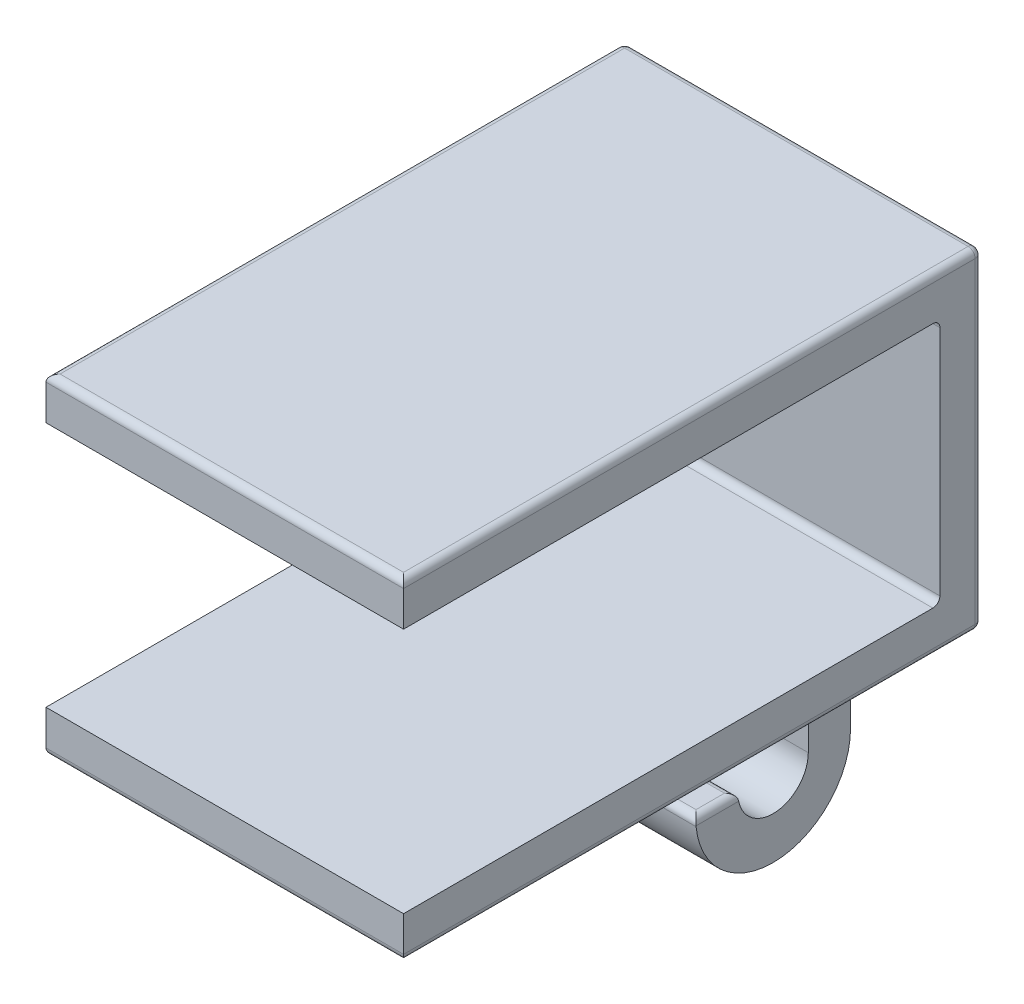
from build123d import *

# Parameters (mm, degrees)
BOSS_EXTRUDE1_DEPTH = 25.4
BOSS_EXTRUDE3_DEPTH = 25.4
CUT_EXTRUDE5_DEPTH  = 6.35
CUT_EXTRUDE6_START  = -6.35
CUT_EXTRUDE6_DEPTH  = 6.35
FILLET1_R           = 2.5
FILLET2_R           = 2.5
FILLET3_R           = 0.5
FILLET4_R           = 0.5
FILLET5_R           = 0.5


with BuildPart() as part:
    # Sketch1 → Boss-Extrude1 (new body)
    with BuildSketch(Plane(origin=(0, 0, 0), x_dir=(0, 0, -1), z_dir=(1, 0, 0))):
        Polygon((0, 0), (38.1, 0), (38.1, -17.5), (0, -17.5), (1.83e-15, -20.500000000000007), (41.1, -20.500000000000007), (41.099999999999994, 3), (-1.8e-16, 2.999999999999995), align=None)
    extrude(amount=BOSS_EXTRUDE1_DEPTH)

    # Sketch7 → Boss-Extrude3 (add)
    with BuildSketch(Plane.ZY):
        with BuildLine():
            Line((-38.1, -20.500000000000007), (-38.10000000000001, -28.33631785905126))
            ThreePointArc((-38.10000000000001, -28.33631785905126), (-32.6, -33.83631785905126), (-27.100000000000005, -28.336317859051263))
            Line((-27.100000000000005, -28.336317859051263), (-30.100000000000005, -28.33631785905126))
            ThreePointArc((-30.100000000000005, -28.33631785905126), (-32.607239712312804, -30.821806864386282), (-35.1, -28.32179632065465))
            Line((-35.1, -28.32179632065465), (-35.1, -20.500000000000007))
            Line((-35.1, -20.500000000000007), (-38.1, -20.500000000000007))
        make_face()
    extrude(amount=-BOSS_EXTRUDE3_DEPTH)

    # Sketch8 → Cut-Extrude5 (cut)
    with BuildSketch(Plane.ZY):
        with BuildLine():
            Line((-35.1, -20.500000000000007), (-38.1, -20.500000000000007))
            Line((-38.1, -20.500000000000007), (-38.10000000000001, -28.3363178590513))
            ThreePointArc((-38.10000000000001, -28.3363178590513), (-32.59999999999998, -33.83631785905126), (-27.100000000000005, -28.336317859051263))
            Line((-27.100000000000005, -28.336317859051263), (-30.10000000000001, -28.33631785905126))
            ThreePointArc((-30.10000000000001, -28.33631785905126), (-32.6072397123128, -30.82180686438628), (-35.1, -28.321796320654666))
            Line((-35.1, -28.321796320654666), (-35.1, -20.500000000000007))
        make_face()
    extrude(amount=-CUT_EXTRUDE5_DEPTH, mode=Mode.SUBTRACT)

    # Sketch9 → Cut-Extrude6 (cut)
    with BuildSketch(Plane(origin=(25.4, 0, 0), x_dir=(0, 0, -1), z_dir=(1, 0, 0)).offset(CUT_EXTRUDE6_START)):
        with BuildLine():
            Line((35.1, -20.500000000000007), (38.1, -20.500000000000007))
            Line((38.1, -20.500000000000007), (38.10000000000001, -28.33631785905126))
            ThreePointArc((38.10000000000001, -28.33631785905126), (32.6, -33.83631785905126), (27.100000000000005, -28.336317859051263))
            Line((27.100000000000005, -28.336317859051263), (30.10000000000001, -28.33631785905126))
            ThreePointArc((30.10000000000001, -28.33631785905126), (32.607239712312804, -30.82180686438628), (35.1, -28.32179632065465))
            Line((35.1, -28.32179632065465), (35.1, -20.500000000000007))
        make_face()
    extrude(amount=CUT_EXTRUDE6_DEPTH, mode=Mode.SUBTRACT)

    # Fillet1
    fillet1_edges = [part.edges().sort_by_distance(p)[0] for p in [
        (12.7, -20.500000000000007, -35.1),
        (12.7, -20.500000000000007, -38.1),
    ]]
    fillet(fillet1_edges, radius=FILLET1_R)

    # Fillet2
    fillet2_edges = [part.edges().sort_by_distance(p)[0] for p in [
        (6.35, -20.500000000000007, -36.599999999999994),
        (19.049999999999997, -20.500000000000007, -36.599999999999994),
    ]]
    fillet(fillet2_edges, radius=FILLET2_R)

    # Fillet3
    fillet3_edges = [part.edges().sort_by_distance(p)[0] for p in [
        (12.7, 2.999999999999995, 1.8e-16),
        (12.7, 3, -41.099999999999994),
        (12.7, -20.500000000000007, -41.1),
        (12.7, -20.500000000000007, -1.83e-15),
        (25.4, -20.500000000000007, -20.550000000000004),
        (25.4, -8.750000000000004, -41.099999999999994),
        (25.4, 2.9999999999999973, -20.549999999999997),
        (0, 2.9999999999999973, -20.549999999999997),
        (0, -8.750000000000004, -41.099999999999994),
        (0, -20.500000000000007, -20.55),
    ]]
    fillet(fillet3_edges, radius=FILLET3_R)

    # Fillet4
    fillet4_edges = [part.edges().sort_by_distance(p)[0] for p in [
        (6.35, -28.336317859051263, -28.60000000000001),
        (12.7, -28.336317859051263, -27.100000000000005),
        (12.7, -28.33631785905126, -30.100000000000005),
        (19.049999999999997, -28.336317859051263, -28.60000000000001),
    ]]
    fillet(fillet4_edges, radius=FILLET4_R)

    # Fillet5
    fillet5_edges = [part.edges().sort_by_distance(p)[0] for p in [
        (12.7, -17.5, -38.1),
        (12.7, 0, -38.1),
    ]]
    fillet(fillet5_edges, radius=FILLET5_R)


solid = part.part
